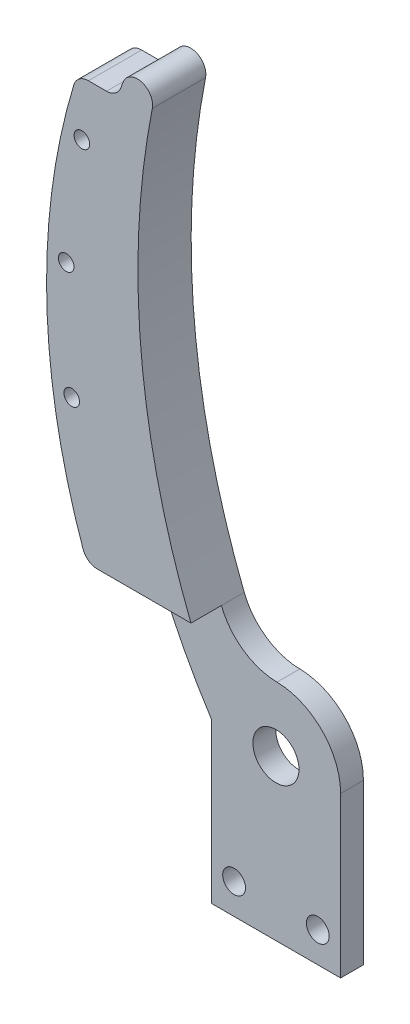
from build123d import *

# Parameters (mm, degrees)
SKETCH_1_R           = 3.5
EXTRUDE_1_DEPTH      = 3
SKETCH_2_R           = 1.5
CUT_EXTRUDE_1_DEPTH  = 10
EXTRUDE_2_DEPTH      = 4
EXTRUDE_5_DEPTH      = 7
FILLET_1_R           = 2
HOLE_WIZARD_M2_5_1_D = 2.05
SKETCH_12_R          = 4.953561737
SKETCH_12_R_2        = 3.03
EXTRUDE_6_DEPTH      = 3


with BuildPart() as part:
    # 草图1 → 凸台-拉伸1 (new body)
    with BuildSketch(Plane.XY):
        with BuildLine():
            Line((0, 0), (17, 0))
            Line((17, 0), (17, 21))
            ThreePointArc((17, 21), (14.559389791, 26.961023013), (8.639106973, 29.498861644))
            ThreePointArc((8.639106973, 29.498861644), (4.214678609, 30.921411086), (1.327625741, 34.563407653))
            ThreePointArc((1.327625741, 34.563407653), (-5.234705957, 62.223549547), (-3.748501306, 90.612611571))
            ThreePointArc((-3.748501306, 90.612611571), (-5.162788524, 92.923505905), (-7.58241645, 91.704554856))
            ThreePointArc((-7.58241645, 91.704554856), (-12.196269834, 55.45091149), (0, 21))
            Line((0, 21), (0, 0))
        make_face()
        with Locations((8.5, 21)):
            Circle(SKETCH_1_R, mode=Mode.SUBTRACT)
    extrude(amount=EXTRUDE_1_DEPTH)

    # 草图2 → 切除-拉伸1 (cut)
    with BuildSketch(Plane(origin=(0, 0, 0), x_dir=(-1, 0, 0), z_dir=(0, 0, -1))):
        with Locations((-14, 4)):
            Circle(SKETCH_2_R)
        with Locations(Location((-3, 4, 0), (0, 0, 180))):
            Circle(SKETCH_2_R)
    extrude(amount=-CUT_EXTRUDE_1_DEPTH, mode=Mode.SUBTRACT)

    # 草图3 → 凸台-拉伸2 (add)
    with BuildSketch(Plane.XY.offset(3)):
        with BuildLine():
            ThreePointArc((-7.58241645, 91.704554856), (-12.6426678, 63.080202535), (-7.007767698, 34.563407653))
            Line((-7.007767698, 34.563407653), (1.327625741, 34.563407653))
            ThreePointArc((1.327625741, 34.563407653), (-5.234705957, 62.223549547), (-3.748501306, 90.612611571))
            ThreePointArc((-3.748501306, 90.612611571), (-5.162788524, 92.923505905), (-7.58241645, 91.704554856))
        make_face()
    extrude(amount=EXTRUDE_2_DEPTH)

    # 草图8 → 凸台-拉伸5 (add)
    with BuildSketch(Plane(origin=(0, 0, 0), x_dir=(-1, 0, 0), z_dir=(0, 0, -1))):
        with BuildLine():
            Line((8.353336216, 89.563407653), (13.622203114, 89.563407653))
            ThreePointArc((13.622203114, 89.563407653), (17.624786926, 61.957713987), (12.366747323, 34.563407653))
            Line((12.366747323, 34.563407653), (7.007767698, 34.563407653))
            ThreePointArc((7.007767698, 34.563407653), (12.623031035, 61.942490485), (8.353336216, 89.563407653))
        make_face()
    extrude(amount=-EXTRUDE_5_DEPTH)

    # 圆角1
    fillet_1_edges = [part.edges().sort_by_distance(p)[0] for p in [
        (-12.366747323, 34.563407653, 3.5),
        (-13.622203114, 89.563407653, 3.5),
        (-8.353336216, 89.563407653, 3.5),
        (-7.007767698, 34.563407653, 1.5),
    ]]
    fillet(fillet_1_edges, radius=FILLET_1_R)

    # M2.5 螺纹孔1 (through all)
    with Locations(Plane(origin=(0, 0, 0), x_dir=(-1, 0, 0), z_dir=(0, 0, -1))):
        with Locations((14.33753876, 52.418963936), (-20.3596947, 65.689324708), (13.008857265, 82.418963936), (15.069556912, 67.418963936)):
            Hole(HOLE_WIZARD_M2_5_1_D / 2)

    # 草图12 → 凸台-拉伸6 (add)
    with BuildSketch(Plane(origin=(0, 0, 0), x_dir=(-1, 0, 0), z_dir=(0, 0, -1))):
        with Locations((-8.5, 21)):
            Circle(SKETCH_12_R)
        with Locations((-8.5, 21)):
            Circle(SKETCH_12_R_2, mode=Mode.SUBTRACT)
    extrude(amount=-EXTRUDE_6_DEPTH)


solid = part.part
